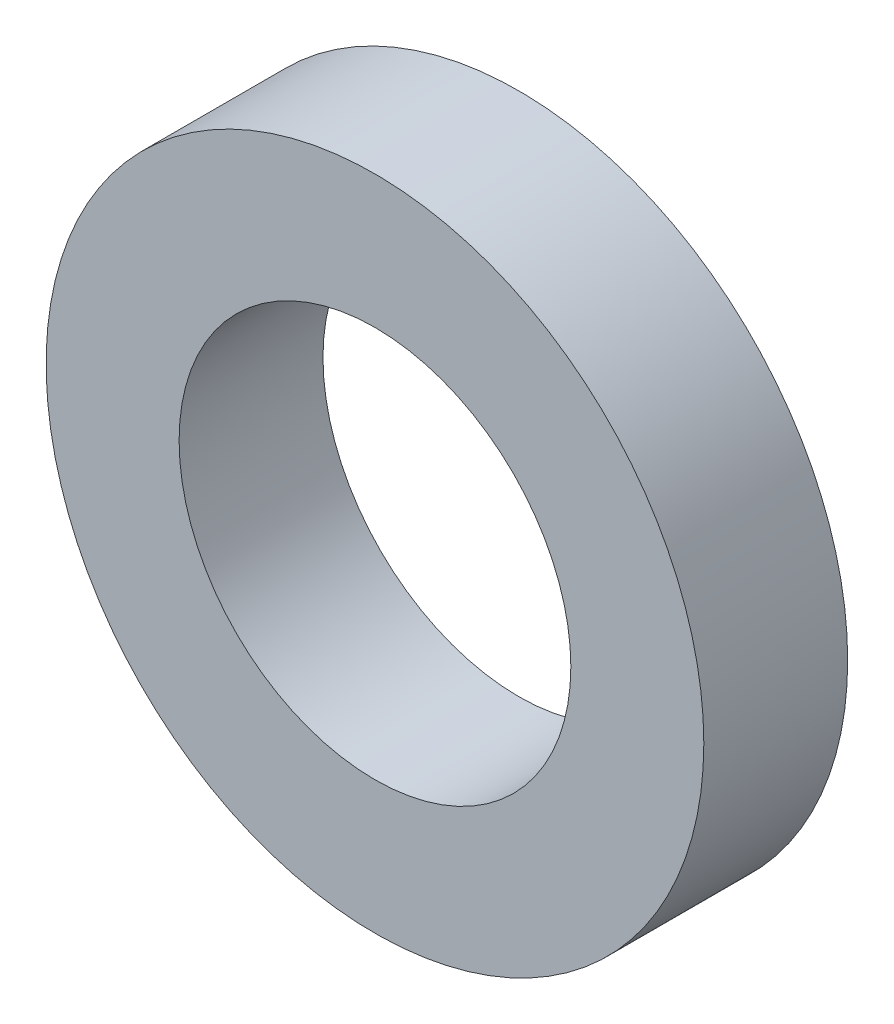
from build123d import *

# Parameters (mm, degrees)
CROQUIS1_R              = 16
CROQUIS1_R_2            = 9.53
SALIENTE_EXTRUIR1_DEPTH = 7


with BuildPart() as part:
    # Croquis1 → Saliente-Extruir1 (new body)
    with BuildSketch(Plane.XY):
        Circle(CROQUIS1_R)
        Circle(CROQUIS1_R_2, mode=Mode.SUBTRACT)
    extrude(amount=SALIENTE_EXTRUIR1_DEPTH)


solid = part.part
